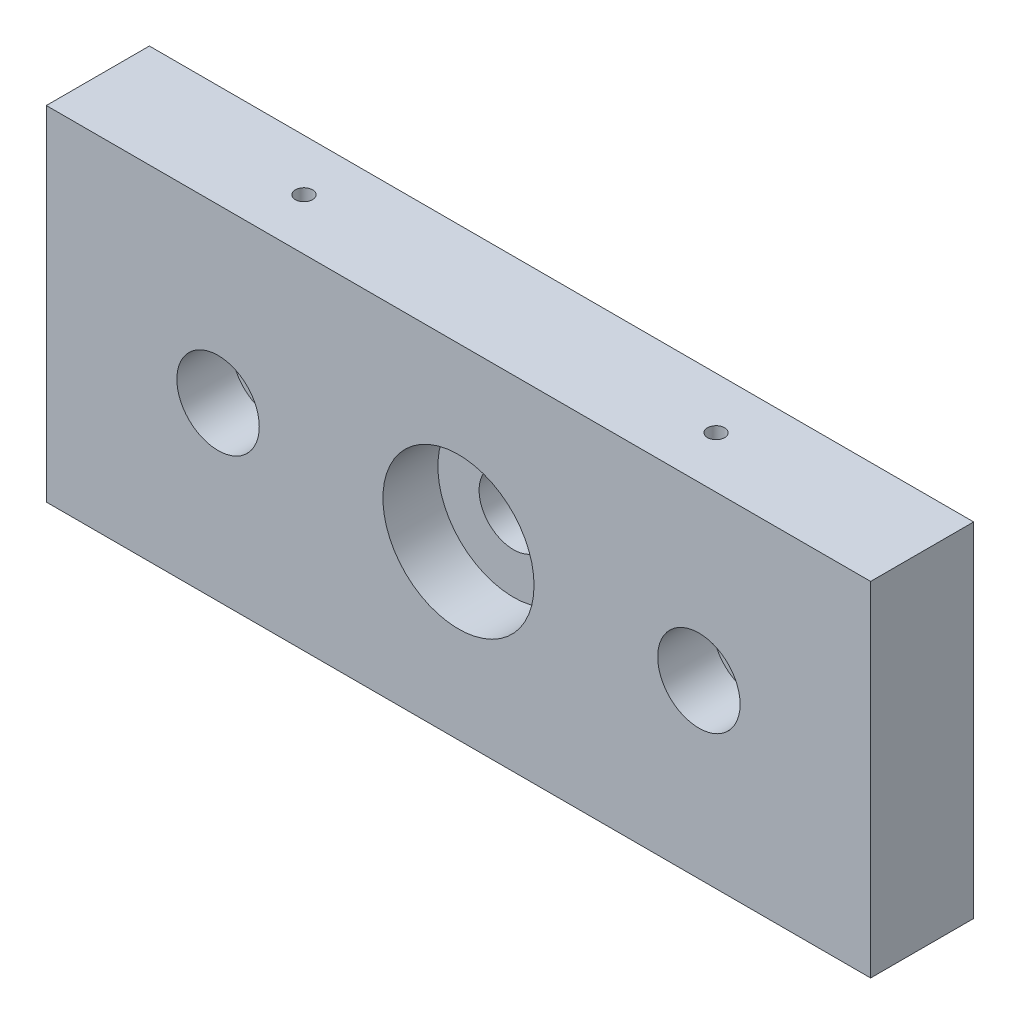
from build123d import *

# Parameters (mm, degrees)
SKETCH_1_W             = 120
SKETCH_1_H             = 50
EXTRUDE_1_DEPTH        = 15
SKETCH_2_R             = 6
CUT_EXTRUDE_1_DEPTH    = 8
SKETCH_3_R             = 11
CUT_EXTRUDE_2_DEPTH    = 8
SKETCH_10_R            = 3.25
CUT_EXTRUDE_4_DEPTH    = 10
SKETCH_11_R            = 5
CUT_EXTRUDE_5_DEPTH    = 10
HOLE_WIZARD_M3_1_D     = 2.5
HOLE_WIZARD_M3_1_DEPTH = 5
HOLE_WIZARD_M3_1_TIP   = 0.751075774
HOLE_WIZARD_M3_2_D     = 2.5
HOLE_WIZARD_M3_2_DEPTH = 5
HOLE_WIZARD_M3_2_TIP   = 0.751075774


with BuildPart() as part:
    # 草图1 → 凸台-拉伸1 (new body)
    with BuildSketch(Plane.XY):
        Rectangle(SKETCH_1_W, SKETCH_1_H)
    extrude(amount=EXTRUDE_1_DEPTH)

    # 草图2 → 切除-拉伸1 (cut)
    with BuildSketch(Plane.XY.offset(15)):
        with Locations((-35, 0)):
            Circle(SKETCH_2_R)
        with Locations((35, 0)):
            Circle(SKETCH_2_R)
    extrude(amount=-CUT_EXTRUDE_1_DEPTH, mode=Mode.SUBTRACT)

    # 草图3 → 切除-拉伸2 (cut)
    with BuildSketch(Plane.XY.offset(15)):
        Circle(SKETCH_3_R)
    extrude(amount=-CUT_EXTRUDE_2_DEPTH, mode=Mode.SUBTRACT)

    # 草图10 → 切除-拉伸4 (cut)
    with BuildSketch(Plane.XY.offset(7)):
        with Locations((-35, 0)):
            Circle(SKETCH_10_R)
        with Locations((35, 0)):
            Circle(SKETCH_10_R)
    extrude(amount=-CUT_EXTRUDE_4_DEPTH, mode=Mode.SUBTRACT)

    # 草图11 → 切除-拉伸5 (cut)
    with BuildSketch(Plane.XY.offset(7)):
        Circle(SKETCH_11_R)
    extrude(amount=-CUT_EXTRUDE_5_DEPTH, mode=Mode.SUBTRACT)

    # M3 螺纹孔1
    with Locations(Plane(origin=(0, 25, 0), x_dir=(1, 0, 0), z_dir=(0, 1, 0))):
        with Locations((30, -7.5), (-30, -7.5)):
            Hole(HOLE_WIZARD_M3_1_D / 2, depth=HOLE_WIZARD_M3_1_DEPTH)
            with Locations((0, 0, -(HOLE_WIZARD_M3_1_DEPTH + HOLE_WIZARD_M3_1_TIP / 2))):  # 118° drill point
                Cone(0, HOLE_WIZARD_M3_1_D / 2, HOLE_WIZARD_M3_1_TIP, mode=Mode.SUBTRACT)

    # M3 螺纹孔2
    with Locations(Plane(origin=(0, -25, 0), x_dir=(-1, 0, 0), z_dir=(0, -1, 0))):
        with Locations((-30, -7.5), (30, -7.5)):
            Hole(HOLE_WIZARD_M3_2_D / 2, depth=HOLE_WIZARD_M3_2_DEPTH)
            with Locations((0, 0, -(HOLE_WIZARD_M3_2_DEPTH + HOLE_WIZARD_M3_2_TIP / 2))):  # 118° drill point
                Cone(0, HOLE_WIZARD_M3_2_D / 2, HOLE_WIZARD_M3_2_TIP, mode=Mode.SUBTRACT)


solid = part.part
